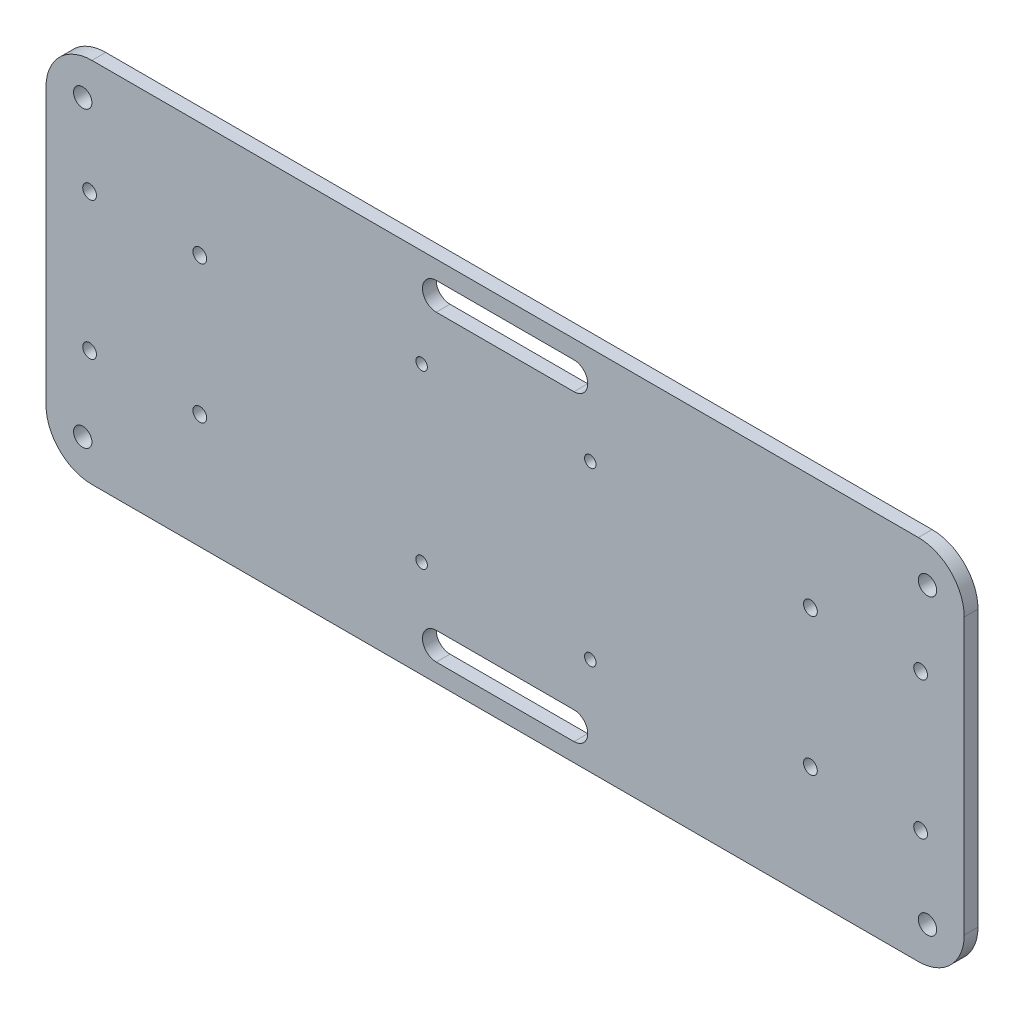
from build123d import *

# Parameters (mm, degrees)
SKETCH1_W           = 200
SKETCH1_H           = 80
BOSS_EXTRUDE1_DEPTH = 3
SKETCH2_R           = 2
CUT_EXTRUDE1_DEPTH  = 108.745069493
FILLET1_R           = 10
CUT_EXTRUDE3_DEPTH  = 108.745069493
SKETCH5_R           = 1.25
CUT_EXTRUDE4_DEPTH  = 108.745069493
SKETCH6_R           = 1.5
CUT_EXTRUDE5_DEPTH  = 108.745069493


with BuildPart() as part:
    # Sketch1 → Boss-Extrude1 (new body)
    with BuildSketch(Plane.XY):
        Rectangle(SKETCH1_W, SKETCH1_H)
    extrude(amount=BOSS_EXTRUDE1_DEPTH)

    # Sketch2 → Cut-Extrude1 (cut, through all)
    with BuildSketch(Plane.XY.offset(3)):
        with Locations((-92, 32)):
            Circle(SKETCH2_R)
        with Locations(Location((-92, -32, 0), (0, 0, 180))):
            Circle(SKETCH2_R)
        with Locations((92, -32)):
            Circle(SKETCH2_R)
        with Locations(Location((92, 32, 0), (0, 0, 180))):
            Circle(SKETCH2_R)
    extrude(amount=-CUT_EXTRUDE1_DEPTH, mode=Mode.SUBTRACT)

    # Fillet1
    fillet1_edges = [part.edges().sort_by_distance(p)[0] for p in [
        (100, -40, 1.5),
        (-100, -40, 1.5),
        (-100, 40, 1.5),
        (100, 40, 1.5),
    ]]
    fillet(fillet1_edges, radius=FILLET1_R)

    # Sketch4 → Cut-Extrude3 (cut, through all)
    with BuildSketch(Plane.XY.offset(3)):
        with BuildLine():
            Line((15, 30), (-15, 30))
            ThreePointArc((-15, 30), (-18, 33), (-15, 36))
            Line((-15, 36), (15, 36))
            ThreePointArc((15, 36), (18, 33), (15, 30))
        make_face()
        with BuildLine():
            Line((15, -30), (-15, -30))
            ThreePointArc((-15, -30), (-18, -33), (-15, -36))
            Line((-15, -36), (15, -36))
            ThreePointArc((15, -36), (18, -33), (15, -30))
        make_face()
    extrude(amount=-CUT_EXTRUDE3_DEPTH, mode=Mode.SUBTRACT)

    # Sketch5 → Cut-Extrude4 (cut, through all)
    with BuildSketch(Plane.XY.offset(3)):
        with Locations((18.55608859, -18.74318761)):
            Circle(SKETCH5_R)
        with Locations((-18.18571173, -18.74318761)):
            Circle(SKETCH5_R)
        with Locations((-18.18571173, 18.63631327)):
            Circle(SKETCH5_R)
        with Locations((18.55608859, 18.63631327)):
            Circle(SKETCH5_R)
    extrude(amount=-CUT_EXTRUDE4_DEPTH, mode=Mode.SUBTRACT)

    # Sketch6 → Cut-Extrude5 (cut, through all)
    with BuildSketch(Plane(origin=(0, 0, 0), x_dir=(-1, 0, 0), z_dir=(0, 0, -1))):
        with Locations((66.5, -15)):
            Circle(SKETCH6_R)
        with Locations((90.5, -15)):
            Circle(SKETCH6_R)
        with Locations((66.5, 15)):
            Circle(SKETCH6_R)
        with Locations((90.5, 15)):
            Circle(SKETCH6_R)
        with Locations((-90.5, -15)):
            Circle(SKETCH6_R)
        with Locations((-66.5, -15)):
            Circle(SKETCH6_R)
        with Locations((-66.5, 15)):
            Circle(SKETCH6_R)
        with Locations((-90.5, 15)):
            Circle(SKETCH6_R)
    extrude(amount=-CUT_EXTRUDE5_DEPTH, mode=Mode.SUBTRACT)


solid = part.part
